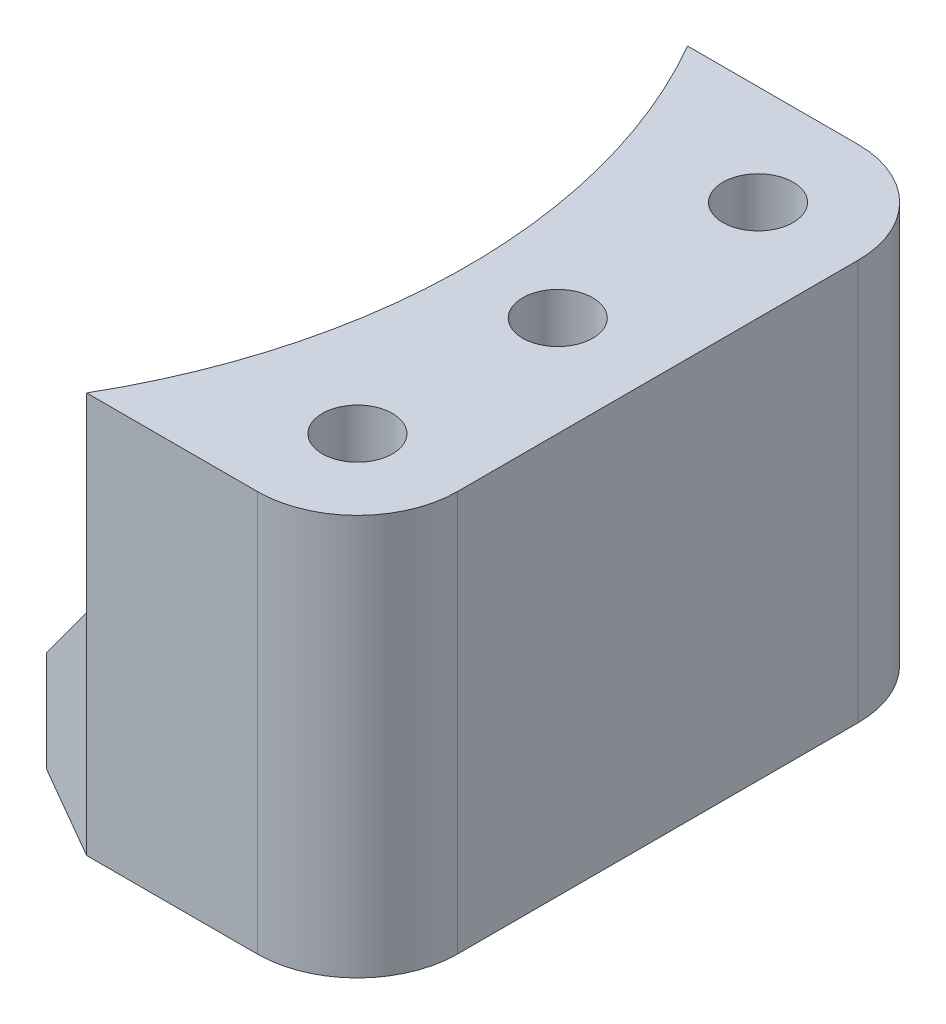
from build123d import *

# Parameters (mm, degrees)
REVOLVE1_ANGLE      = 60
SKETCH2_OUTSIDE_W   = 36.094
SKETCH2_OUTSIDE_H   = 57.312
SKETCH2_OUTSIDE_W_2 = 27.637577589
SKETCH2_OUTSIDE_H_2 = 30
CUT_EXTRUDE2_DEPTH  = 40
FILLET1_R           = 5
SKETCH3_R           = 1.75
CUT_EXTRUDE3_DEPTH  = 40


with BuildPart() as part:
    # Sketch1 → Revolve1 (revolve, symmetric)
    with BuildSketch(Plane.XY) as revolve1_sk:
        Polygon((30, 20), (30, 10.5), (24.5, 5), (24.5, 0), (44.5, 0), (44.5, 20), align=None)
    revolve(axis=Axis((0, 0, 0), (0, 1, 0)), revolution_arc=REVOLVE1_ANGLE / 2)
    revolve(revolve1_sk.sketch, axis=Axis((0, 0, 0), (0, -1, 0)), revolution_arc=REVOLVE1_ANGLE / 2)

    # Sketch2 outside → Cut-Extrude2 (cut)
    with BuildSketch(Plane(origin=(0, 0, 0), x_dir=(1, 0, 0), z_dir=(0, 1, 0))):
        with Locations((32.859, 0)):
            Rectangle(SKETCH2_OUTSIDE_W, SKETCH2_OUTSIDE_H)
        with Locations((25.681211205, 0)):
            Rectangle(SKETCH2_OUTSIDE_W_2, SKETCH2_OUTSIDE_H_2, mode=Mode.SUBTRACT)
    extrude(amount=CUT_EXTRUDE2_DEPTH, mode=Mode.SUBTRACT)

    # Fillet1
    fillet1_edges = [part.edges().sort_by_distance(p)[0] for p in [
        (39.5, 10, -15),
        (39.5, 10, 15),
    ]]
    fillet(fillet1_edges, radius=FILLET1_R)

    # Sketch3 → Cut-Extrude3 (cut)
    with BuildSketch(Plane(origin=(0, 20, 0), x_dir=(1, 0, 0), z_dir=(0, 1, 0))):
        with Locations(Location((34.5, -10, 0), (0, 0, 270))):
            Circle(SKETCH3_R)
        with Locations(Location((34.5, 10, 0), (0, 0, 270))):
            Circle(SKETCH3_R)
        with Locations(Location((34.5, 0, 0), (0, 0, 270))):
            Circle(SKETCH3_R)
    extrude(amount=-CUT_EXTRUDE3_DEPTH, mode=Mode.SUBTRACT)


solid = part.part
